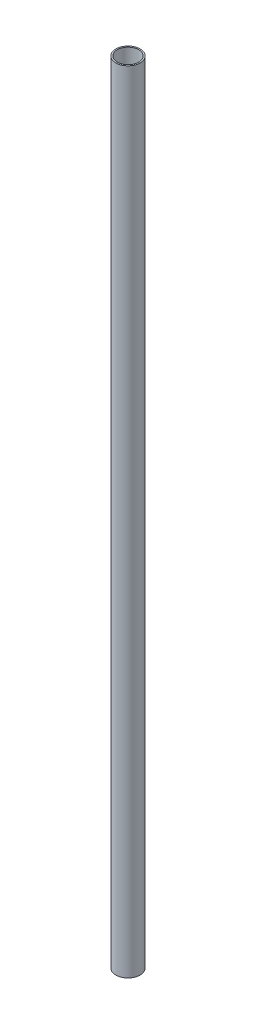
from build123d import *

# Parameters (mm, degrees)
SKETCH1_R           = 20
SKETCH1_R_2         = 17.7
BOSS_EXTRUDE1_DEPTH = 1300


with BuildPart() as part:
    # Sketch1 → Boss-Extrude1 (new body)
    with BuildSketch(Plane(origin=(0, 0, 0), x_dir=(1, 0, 0), z_dir=(0, 1, 0))):
        with Locations(Location((0, 0, 0), (0, 0, 270))):
            Circle(SKETCH1_R)
        with Locations(Location((0, 0, 0), (0, 0, 270))):
            Circle(SKETCH1_R_2, mode=Mode.SUBTRACT)
    extrude(amount=BOSS_EXTRUDE1_DEPTH)


solid = part.part
